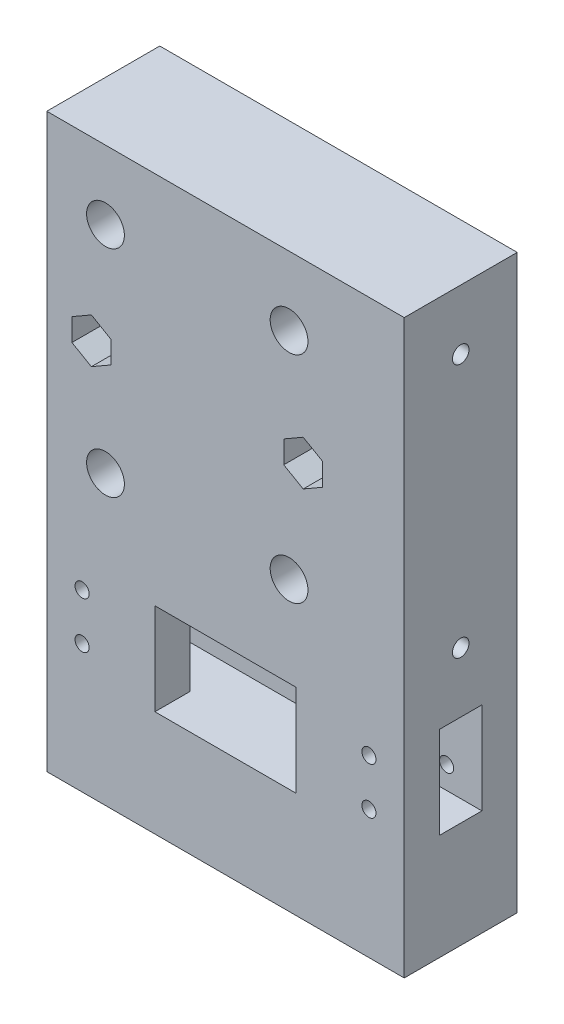
from build123d import *

# Parameters (mm, degrees)
SKETCH1_W               = 42.62295082
SKETCH1_H               = 50
SKETCH1_R               = 2.677018134
BOSS_EXTRUDE1_DEPTH     = 16
SKETCH2_R               = 11
CUT_EXTRUDE2_DEPTH      = 11
SKETCH3_R               = 1.75
CUT_EXTRUDE3_DEPTH      = 10
CUT_EXTRUDE6_START      = -5
CUT_EXTRUDE6_DEPTH      = 32.540101042
SKETCH10_W              = 42.62295082
SKETCH10_H              = 16
BOSS_EXTRUDE2_DEPTH     = 16
SKETCH14_W              = 6
SKETCH14_H              = 13
CUT_EXTRUDE7_DEPTH      = 62.267576552
BOSS_EXTRUDE3_DEPTH     = 8
CUT_EXTRUDE9_DEPTH      = 8
SKETCH18_W              = 0.9
SKETCH18_H              = 4
SKETCH18_W_2            = 1.8
CUT_EXTRUDE10_DEPTH     = 10.2
CUT_EXTRUDE8_DEPTH      = 53.87875368
CUT_EXTRUDE8_DEPTH_BACK = 53.87875368
SKETCH15_R              = 1
CUT_EXTRUDE5_DEPTH      = 61.126222156
CUT_EXTRUDE5_DEPTH_BACK = 20
SKETCH6_W               = 9.034037672
SKETCH6_H               = 2.387531408
SKETCH20_W              = 8
SKETCH20_H              = 16
BOSS_EXTRUDE5_DEPTH     = 13
SKETCH21_W              = 8
SKETCH21_H              = 6
CUT_EXTRUDE11_DEPTH     = 13
SKETCH22_R              = 1
CUT_EXTRUDE12_DEPTH     = 53.87875368
SKETCH24_W              = 50.62295082
SKETCH24_H              = 5
BOSS_EXTRUDE6_DEPTH     = 15
SKETCH25_W              = 50.62295082
SKETCH25_H              = 15
BOSS_EXTRUDE7_DEPTH     = 11
SKETCH26_R              = 1
CUT_EXTRUDE13_DEPTH     = 10
SKETCH27_W              = 4
SKETCH27_H              = 1.8
CUT_EXTRUDE14_DEPTH     = 10.2
SKETCH29_W              = 20
SKETCH29_H              = 3.2
CUT_EXTRUDE15_DEPTH     = 5


with BuildPart() as part:
    # Sketch1 → Boss-Extrude1 (new body)
    with BuildSketch(Plane.XY):
        Rectangle(SKETCH1_W, SKETCH1_H)
        with Locations((-13, -15.25)):
            Circle(SKETCH1_R, mode=Mode.SUBTRACT)
        with Locations(Location((13, -15.25, 0), (0, 0, 180))):
            Circle(SKETCH1_R, mode=Mode.SUBTRACT)
        with Locations((13, 15.25)):
            Circle(SKETCH1_R, mode=Mode.SUBTRACT)
        with Locations(Location((-13, 15.25, 0), (0, 0, 180))):
            Circle(SKETCH1_R, mode=Mode.SUBTRACT)
    extrude(amount=BOSS_EXTRUDE1_DEPTH)

    # Sketch2 → Cut-Extrude2 (cut)
    with BuildSketch(Plane.XY):
        Circle(SKETCH2_R)
    extrude(amount=CUT_EXTRUDE2_DEPTH, mode=Mode.SUBTRACT)

    # Sketch3 → Cut-Extrude3 (cut)
    with BuildSketch(Plane(origin=(0, 0, 0), x_dir=(-1, 0, 0), z_dir=(0, 0, -1))):
        with Locations((-15, 0)):
            Circle(SKETCH3_R)
        with Locations(Location((15, 0, 0), (0, 0, 180))):
            Circle(SKETCH3_R)
    extrude(amount=-CUT_EXTRUDE3_DEPTH, mode=Mode.SUBTRACT)

    # Sketch9 → Cut-Extrude6 (cut, through all)
    with BuildSketch(Plane(origin=(0, 0, 0), x_dir=(-1, 0, 0), z_dir=(0, 0, -1)).offset(CUT_EXTRUDE6_START)):
        Polygon((-15, 3.175426481), (-17.75, 1.58771324), (-17.75, -1.58771324), (-15, -3.175426481), (-12.25, -1.58771324), (-12.25, 1.58771324), align=None)
        Polygon((12.25, 1.58771324), (15, 3.175426481), (17.75, 1.58771324), (17.75, -1.58771324), (15, -3.175426481), (12.25, -1.58771324), align=None)
    extrude(amount=-CUT_EXTRUDE6_DEPTH, mode=Mode.SUBTRACT)

    # Sketch10 → Boss-Extrude2 (add)
    with BuildSketch(Plane.XY):
        with Locations((0, -33)):
            Rectangle(SKETCH10_W, SKETCH10_H)
    extrude(amount=BOSS_EXTRUDE2_DEPTH)

    # Sketch14 → Cut-Extrude7 (cut, through all)
    with BuildSketch(Plane.ZY.offset(21.31147541)):
        with Locations((8, -34.5)):
            Rectangle(SKETCH14_W, SKETCH14_H)
    extrude(amount=-CUT_EXTRUDE7_DEPTH, mode=Mode.SUBTRACT)

    # Sketch16 → Boss-Extrude3 (add)
    with BuildSketch(Plane(origin=(21.31147541, 0, 0), x_dir=(0, 0, -1), z_dir=(1, 0, 0))):
        Polygon((-11, -28), (-8, -28), (-8, 25), (-16, 25), (-16, -28), align=None)
        Polygon((-8, 25), (-8, -28), (-5, -28), (0, -28), (0, 25), align=None)
    extrude(amount=BOSS_EXTRUDE3_DEPTH)

    # Sketch17 → Cut-Extrude9 (cut)
    with BuildSketch(Plane(origin=(29.31147541, 0, 0), x_dir=(0, 0, -1), z_dir=(1, 0, 0))):
        with BuildLine():
            ThreePointArc((-8, 17.675), (-9.175, 16.5), (-8, 15.325))
            Line((-8, 15.325), (-8, 17.675))
        make_face()
        with BuildLine():
            Line((-8, 17.675), (-8, 15.325))
            ThreePointArc((-8, 15.325), (-7.169149532, 15.669149532), (-6.825, 16.5))
            ThreePointArc((-6.825, 16.5), (-7.169149532, 17.330850468), (-8, 17.675))
        make_face()
        with BuildLine():
            ThreePointArc((-8, -18.325), (-9.175, -19.5), (-8, -20.675))
            Line((-8, -20.675), (-8, -18.325))
        make_face()
        with BuildLine():
            Line((-8, -18.325), (-8, -20.675))
            ThreePointArc((-8, -20.675), (-7.169149532, -20.330850468), (-6.825, -19.5))
            ThreePointArc((-6.825, -19.5), (-7.169149532, -18.669149532), (-8, -18.325))
        make_face()
    extrude(amount=-CUT_EXTRUDE9_DEPTH, mode=Mode.SUBTRACT)

    # Sketch18 → Cut-Extrude10 (cut)
    with BuildSketch(Plane(origin=(0, 0, 0), x_dir=(-1, 0, 0), z_dir=(0, 0, -1))):
        with Locations((-24.86147541, 16.5)):
            Rectangle(SKETCH18_W, SKETCH18_H)
        with Locations((-25.76147541, 16.5)):
            Rectangle(SKETCH18_W, SKETCH18_H)
        with Locations((-25.31147541, -19.5)):
            Rectangle(SKETCH18_W_2, SKETCH18_H)
    extrude(amount=-CUT_EXTRUDE10_DEPTH, mode=Mode.SUBTRACT)

    # Sketch15 → Cut-Extrude8 (cut, two sides: drawn at the far end of the back side and taken through both)
    with BuildSketch(Plane(origin=(0, 0, 0), x_dir=(-1, 0, 0), z_dir=(0, 0, -1)).offset(-CUT_EXTRUDE8_DEPTH_BACK)):
        with Locations(Location((16.31147541, -37.8, 0), (0, 0, 270))):
            Circle(SKETCH15_R)
        with Locations((16.31147541, -31.2)):
            Circle(SKETCH15_R)
    extrude(amount=CUT_EXTRUDE8_DEPTH + CUT_EXTRUDE8_DEPTH_BACK, mode=Mode.SUBTRACT)

    # Sketch6 → Cut-Extrude5 (cut, two sides: drawn at the far end of the back side and taken through both)
    with BuildSketch(Plane.XZ.offset(25).offset(-CUT_EXTRUDE5_DEPTH_BACK)):
        with Locations((0, 12.193765704)):
            Rectangle(SKETCH6_W, SKETCH6_H)
    extrude(amount=CUT_EXTRUDE5_DEPTH + CUT_EXTRUDE5_DEPTH_BACK, mode=Mode.SUBTRACT)

    # Sketch20 → Boss-Extrude5 (add)
    with BuildSketch(Plane(origin=(0, -28, 0), x_dir=(-1, 0, 0), z_dir=(0, -1, 0))):
        with Locations((-25.31147541, -8)):
            Rectangle(SKETCH20_W, SKETCH20_H)
    extrude(amount=BOSS_EXTRUDE5_DEPTH)

    # Sketch21 → Cut-Extrude11 (cut)
    with BuildSketch(Plane(origin=(0, -41, 0), x_dir=(-1, 0, 0), z_dir=(0, -1, 0))):
        with Locations((-25.31147541, -8)):
            Rectangle(SKETCH21_W, SKETCH21_H)
    extrude(amount=-CUT_EXTRUDE11_DEPTH, mode=Mode.SUBTRACT)

    # Sketch22 → Cut-Extrude12 (cut, through all)
    with BuildSketch(Plane(origin=(0, 0, 0), x_dir=(-1, 0, 0), z_dir=(0, 0, -1))):
        with Locations((-24.31147541, -37.8)):
            Circle(SKETCH22_R)
        with Locations((-24.31147541, -31.2)):
            Circle(SKETCH22_R)
    extrude(amount=-CUT_EXTRUDE12_DEPTH, mode=Mode.SUBTRACT)

    # Sketch24 → Boss-Extrude6 (add)
    with BuildSketch(Plane.XZ.offset(41)):
        with Locations((4, 2.5)):
            Rectangle(SKETCH24_W, SKETCH24_H)
    extrude(amount=BOSS_EXTRUDE6_DEPTH)

    # Sketch25 → Boss-Extrude7 (add)
    with BuildSketch(Plane.XY.offset(5)):
        with Locations((4, -48.5)):
            Rectangle(SKETCH25_W, SKETCH25_H)
    extrude(amount=BOSS_EXTRUDE7_DEPTH)

    # Sketch26 → Cut-Extrude13 (cut)
    with BuildSketch(Plane.XZ.offset(56)):
        with BuildLine():
            ThreePointArc((-15, 8), (-14, 7), (-13, 8))
            Line((-13, 8), (-15, 8))
        make_face()
        with BuildLine():
            Line((-15, 8), (-13, 8))
            ThreePointArc((-13, 8), (-14, 9), (-15, 8))
        make_face()
        with Locations(Location((22, 8, 0), (0, 0, 270))):
            Circle(SKETCH26_R)
    extrude(amount=-CUT_EXTRUDE13_DEPTH, mode=Mode.SUBTRACT)

    # Sketch27 → Cut-Extrude14 (cut)
    with BuildSketch(Plane(origin=(0, 0, 0), x_dir=(-1, 0, 0), z_dir=(0, 0, -1))):
        with Locations((-22.00147541, -52)):
            Rectangle(SKETCH27_W, SKETCH27_H)
        with Locations((14.00147541, -52)):
            Rectangle(SKETCH27_W, SKETCH27_H)
    extrude(amount=-CUT_EXTRUDE14_DEPTH, mode=Mode.SUBTRACT)

    # Sketch29 → Cut-Extrude15 (cut)
    with BuildSketch(Plane.XY.offset(16)):
        with Locations((4, -29.6)):
            Rectangle(SKETCH29_W, SKETCH29_H)
        Polygon((-6, -31.2), (-6, -32.875302663), (4, -34.5), (14, -32.875302663), (14, -31.2), align=None)
        Polygon((4, -34.5), (-6, -32.875302663), (-6, -36.124697337), align=None)
        with Locations((4, -39.4)):
            Rectangle(SKETCH29_W, SKETCH29_H)
        Polygon((14, -36.124697337), (4, -34.5), (-6, -36.124697337), (-6, -37.8), (14, -37.8), align=None)
        Polygon((14, -32.875302663), (4, -34.5), (14, -36.124697337), align=None)
    extrude(amount=-CUT_EXTRUDE15_DEPTH, mode=Mode.SUBTRACT)


solid = part.part
